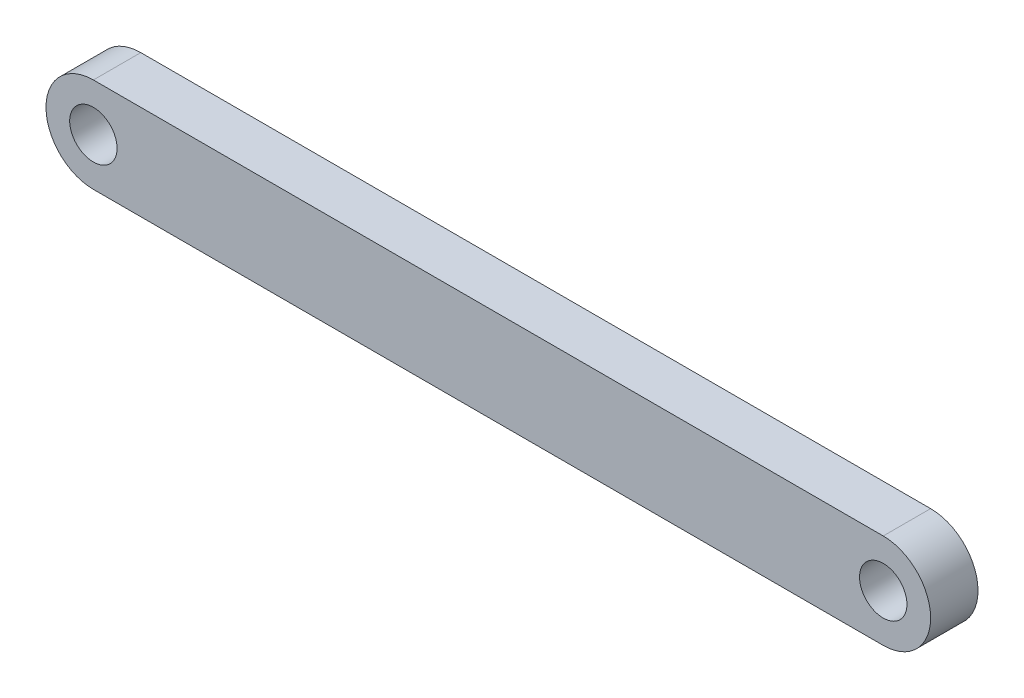
from build123d import *

# Parameters (mm, degrees)
SKETCH2_R           = 1.5
BOSS_EXTRUDE1_DEPTH = 3


with BuildPart() as part:
    # Sketch2 → Boss-Extrude1 (new body)
    with BuildSketch(Plane.XY):
        with BuildLine():
            Line((-50, 3), (0, 3))
            ThreePointArc((0, 3), (3, 0), (0, -3))
            Line((0, -3), (-50, -3))
            ThreePointArc((-50, -3), (-53, 0), (-50, 3))
        make_face()
        with Locations((-50, 0)):
            Circle(SKETCH2_R, mode=Mode.SUBTRACT)
        Circle(SKETCH2_R, mode=Mode.SUBTRACT)
    extrude(amount=BOSS_EXTRUDE1_DEPTH)


solid = part.part
